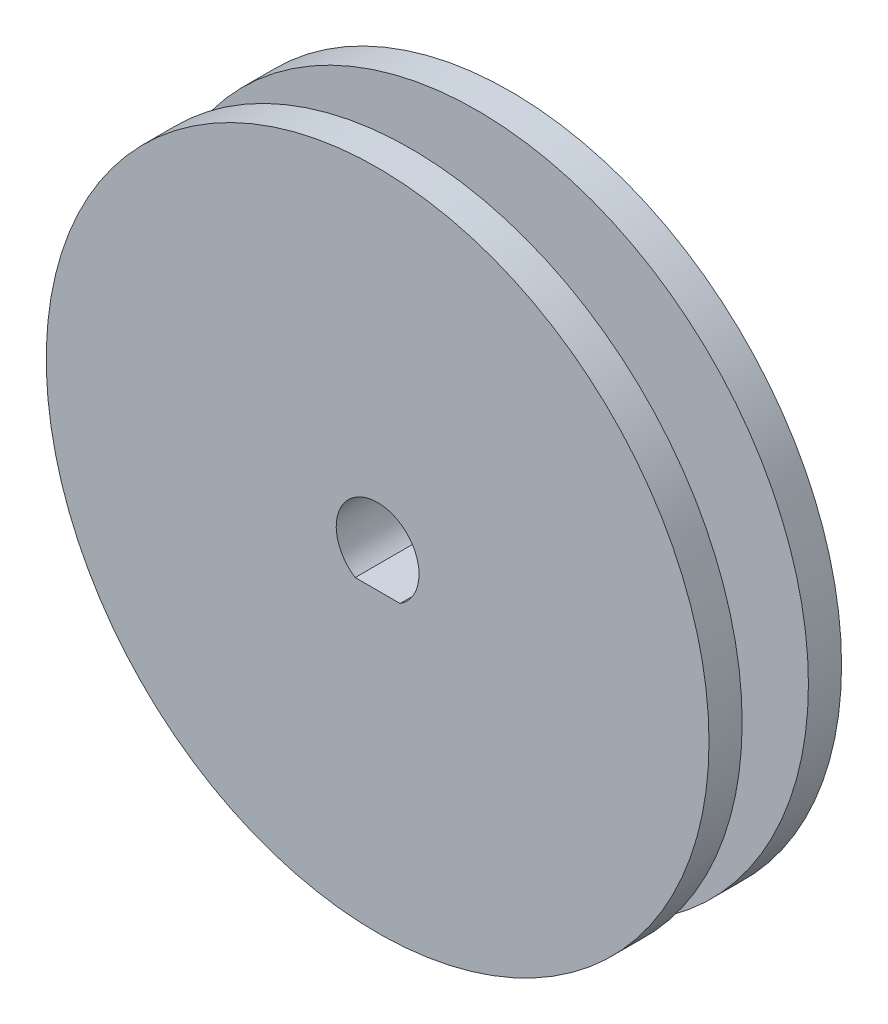
from build123d import *

# Parameters (mm, degrees)
SKETCH_1_R          = 20
EXTRUDE_1_DEPTH     = 2
SKETCH_2_R          = 10
EXTRUDE_2_DEPTH     = 4
SKETCH_3_R          = 1
EXTRUDE_3_DEPTH     = 4
CUT_EXTRUDE_1_DEPTH = 8


with BuildPart() as part:
    # 草图1 → 凸台-拉伸1 (new body)
    with BuildSketch(Plane.XY):
        Circle(SKETCH_1_R)
    extrude_1 = extrude(amount=EXTRUDE_1_DEPTH)

    # 草图2 → 凸台-拉伸2 (add)
    with BuildSketch(Plane.XY.offset(2)):
        Circle(SKETCH_2_R)
    extrude(amount=EXTRUDE_2_DEPTH)

    # 草图3 → 凸台-拉伸3 (add)
    with BuildSketch(Plane.XY.offset(2)):
        with Locations((0.039532003, 11.681707008)):
            Circle(SKETCH_3_R)
    extrude(amount=EXTRUDE_3_DEPTH)

    # 镜向2: 凸台-拉伸1 across plane
    add(extrude_1.mirror(Plane.XY.offset(4)))

    # 草图4 → 切除-拉伸1 (cut)
    with BuildSketch(Plane.XY.offset(8)):
        with BuildLine():
            Line((-1.356465997, -2.1), (1.356465997, -2.1))
            ThreePointArc((1.356465997, -2.1), (0, 2.5), (-1.356465997, -2.1))
        make_face()
    extrude(amount=-CUT_EXTRUDE_1_DEPTH, mode=Mode.SUBTRACT)


solid = part.part
